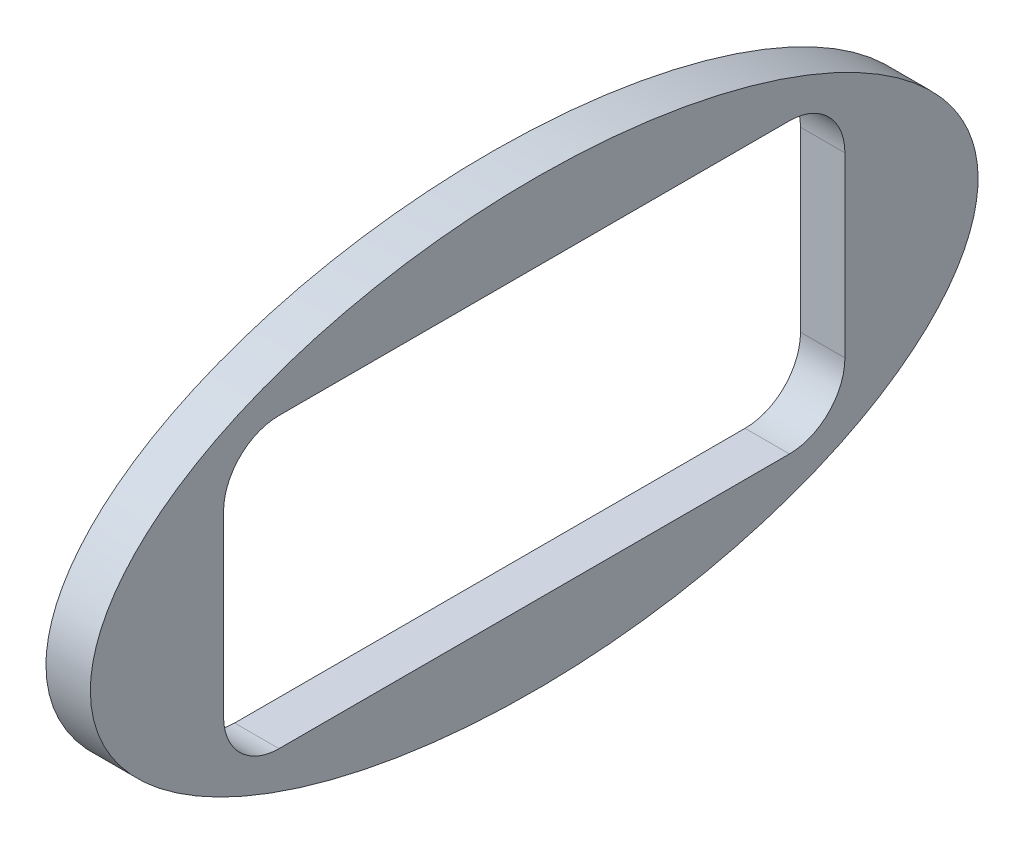
from build123d import *

# Parameters (mm, degrees)
OUTER_SKETCH_RX   = 10
OUTER_SKETCH_RY   = 5
LED_BODY_DEPTH    = 1
LED_SURFACE_DEPTH = 12.22497216


with BuildPart() as part:
    # Outer_sketch → LED_body (new body)
    with BuildSketch(Plane(origin=(0, 0, 0), x_dir=(0, 0, -1), z_dir=(1, 0, 0))):
        with Locations(Location((0, 0), (0, 0, 180))):
            Ellipse(OUTER_SKETCH_RX, OUTER_SKETCH_RY)
    extrude(amount=LED_BODY_DEPTH)

    # Hole_sketch → LED_surface (cut, through all)
    with BuildSketch(Plane(origin=(0, 0, 0), x_dir=(0, 0, -1), z_dir=(1, 0, 0))):
        with BuildLine():
            Line((-7, -2), (-7, 2))
            ThreePointArc((-7, 2), (-6.633883476, 2.883883476), (-5.75, 3.25))
            Line((-5.75, 3.25), (5.75, 3.25))
            ThreePointArc((5.75, 3.25), (6.633883476, 2.883883476), (7, 2))
            Line((7, 2), (7, -2))
            ThreePointArc((7, -2), (6.633883476, -2.883883476), (5.75, -3.25))
            Line((5.75, -3.25), (-5.75, -3.25))
            ThreePointArc((-5.75, -3.25), (-6.633883476, -2.883883476), (-7, -2))
        make_face()
    extrude(amount=LED_SURFACE_DEPTH, mode=Mode.SUBTRACT)


solid = part.part
